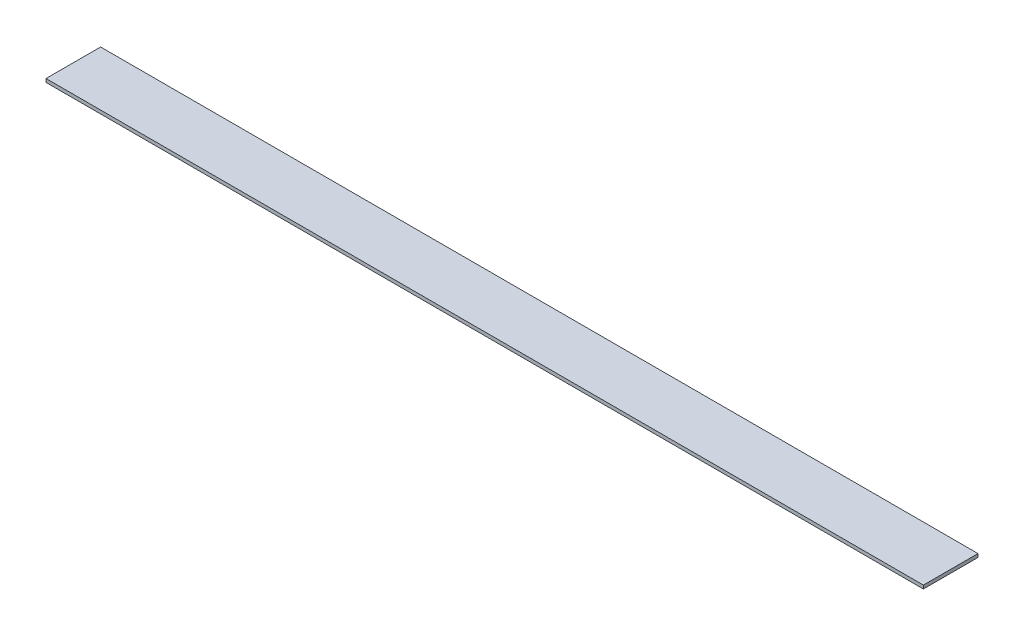
from build123d import *

# Parameters (mm, degrees)
SKETCH1_W           = 816.30012
SKETCH1_H           = 50.8
BOSS_EXTRUDE1_DEPTH = 3.175


with BuildPart() as part:
    # Sketch1 → Boss-Extrude1 (new body)
    with BuildSketch(Plane(origin=(0, 0, 0), x_dir=(1, 0, 0), z_dir=(0, 1, 0))):
        with Locations((408.15006, 25.4)):
            Rectangle(SKETCH1_W, SKETCH1_H)
    extrude(amount=BOSS_EXTRUDE1_DEPTH)


solid = part.part
